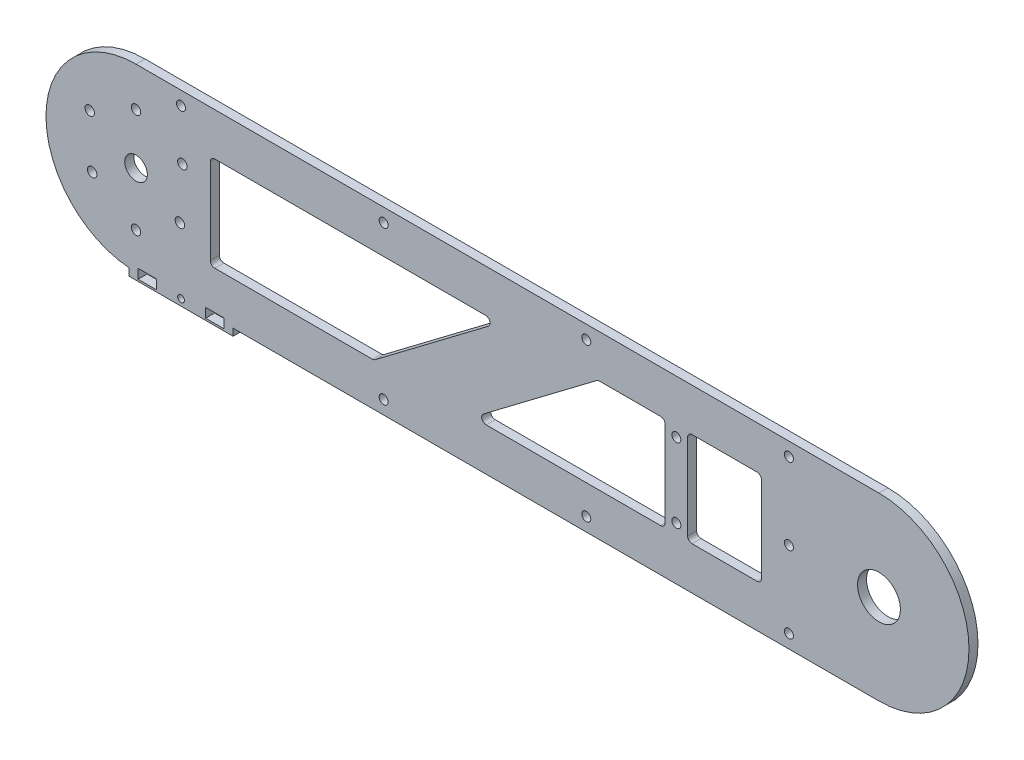
from build123d import *

# Parameters (mm, degrees)
SKETCH_1_R          = 2.1
SKETCH_1_R_2        = 5.02
SKETCH_1_R_3        = 2
SKETCH_1_R_4        = 9.52
EXTRUDE_1_DEPTH     = 4
SKETCH_3_W          = 46.2
SKETCH_3_H          = 3.817212264
EXTRUDE_2_DEPTH     = 4
SKETCH_2_R          = 2
SKETCH_2_R_2        = 1.5
SKETCH_2_W          = 32.809844138
SKETCH_2_H          = 42
SKETCH_2_W_2        = 8.2
SKETCH_2_H_2        = 4.2
CUT_EXTRUDE_1_DEPTH = 4
FILLET_1_R          = 2


with BuildPart() as part:
    # 草图1 → 凸台-拉伸1 (new body)
    with BuildSketch(Plane.XY):
        with BuildLine():
            ThreePointArc((-1.457142857, 39.854285714), (-41.457142857, -0.145714286), (-1.457142857, -40.145714286))
            Line((-1.457142857, -40.145714286), (328.542857143, -40.145714286))
            ThreePointArc((328.542857143, -40.145714286), (368.542857143, -0.145714286), (328.542857143, 39.854285714))
            Line((328.542857143, 39.854285714), (-1.457142857, 39.854285714))
        make_face()
        with Locations((-1.457142857, -23.895714286)):
            Circle(SKETCH_1_R, mode=Mode.SUBTRACT)
        with Locations((-20.942714442, -11.395714286)):
            Circle(SKETCH_1_R, mode=Mode.SUBTRACT)
        with Locations((18.028428728, -11.395714286)):
            Circle(SKETCH_1_R, mode=Mode.SUBTRACT)
        with Locations((-1.457142857, -0.145714286)):
            Circle(SKETCH_1_R_2, mode=Mode.SUBTRACT)
        with Locations((238.542857143, -16.645714286)):
            Circle(SKETCH_1_R_3, mode=Mode.SUBTRACT)
        with Locations((288.542857143, -0.145714286)):
            Circle(SKETCH_1_R_3, mode=Mode.SUBTRACT)
        with Locations((328.542857143, -0.145714286)):
            Circle(SKETCH_1_R_4, mode=Mode.SUBTRACT)
        with Locations((-22.025246197, 11.729285714)):
            Circle(SKETCH_1_R, mode=Mode.SUBTRACT)
        with Locations((19.110960483, 11.729285714)):
            Circle(SKETCH_1_R, mode=Mode.SUBTRACT)
        with Locations((-1.457142857, 22.354285714)):
            Circle(SKETCH_1_R, mode=Mode.SUBTRACT)
        with Locations((238.542857143, 16.354285714)):
            Circle(SKETCH_1_R_3, mode=Mode.SUBTRACT)
    extrude(amount=EXTRUDE_1_DEPTH)

    # 草图3 → 凸台-拉伸2 (add)
    with BuildSketch(Plane.XY.offset(4)):
        with Locations((18.542857143, -41.36131722)):
            Rectangle(SKETCH_3_W, SKETCH_3_H)
    extrude(amount=-EXTRUDE_2_DEPTH)

    # 草图2 → 切除-拉伸1 (cut)
    with BuildSketch(Plane.XY.offset(4)):
        with Locations((18.542857143, 33.854285714)):
            Circle(SKETCH_2_R)
        with Locations((108.542857143, 33.854285714)):
            Circle(SKETCH_2_R)
        with Locations((198.542857143, 33.854285714)):
            Circle(SKETCH_2_R)
        with Locations((288.542857143, 33.854285714)):
            Circle(SKETCH_2_R)
        with Locations((108.542857143, -34.145714286)):
            Circle(SKETCH_2_R)
        with Locations((198.542857143, -34.145714286)):
            Circle(SKETCH_2_R)
        with Locations((288.542857143, -34.145714286)):
            Circle(SKETCH_2_R)
        with Locations((18.542857143, -40.329923352)):
            Circle(SKETCH_2_R_2)
        Polygon((31.542857143, -21.145714286), (104.183898028, -21.145714286), (159.772133322, 20.854285714), (31.542857143, 20.854285714), align=None)
        Polygon((148.123425102, -21.145714286), (203.711660396, 20.854285714), (233.542857143, 20.854285714), (233.542857143, -21.145714286), align=None)
        with Locations((259.947779212, -0.145714286)):
            Rectangle(SKETCH_2_W, SKETCH_2_H)
        with Locations((33.542857143, -40.329923352)):
            Rectangle(SKETCH_2_W_2, SKETCH_2_H_2)
        with Locations((3.542857143, -40.329923352)):
            Rectangle(SKETCH_2_W_2, SKETCH_2_H_2)
    extrude(amount=-CUT_EXTRUDE_1_DEPTH, mode=Mode.SUBTRACT)

    # 圆角1
    fillet_1_edges = [part.edges().sort_by_distance(p)[0] for p in [
        (243.542857143, 20.854285714, 2),
        (276.352701281, 20.854285714, 2),
        (276.352701281, -21.145714286, 2),
        (243.542857143, -21.145714286, 2),
        (31.542857143, -21.145714286, 2),
        (31.542857143, 20.854285714, 2),
        (159.772133322, 20.854285714, 2),
        (104.183898028, -21.145714286, 2),
        (203.711660396, 20.854285714, 2),
        (233.542857143, 20.854285714, 2),
        (233.542857143, -21.145714286, 2),
        (148.123425102, -21.145714286, 2),
    ]]
    fillet(fillet_1_edges, radius=FILLET_1_R)


solid = part.part
